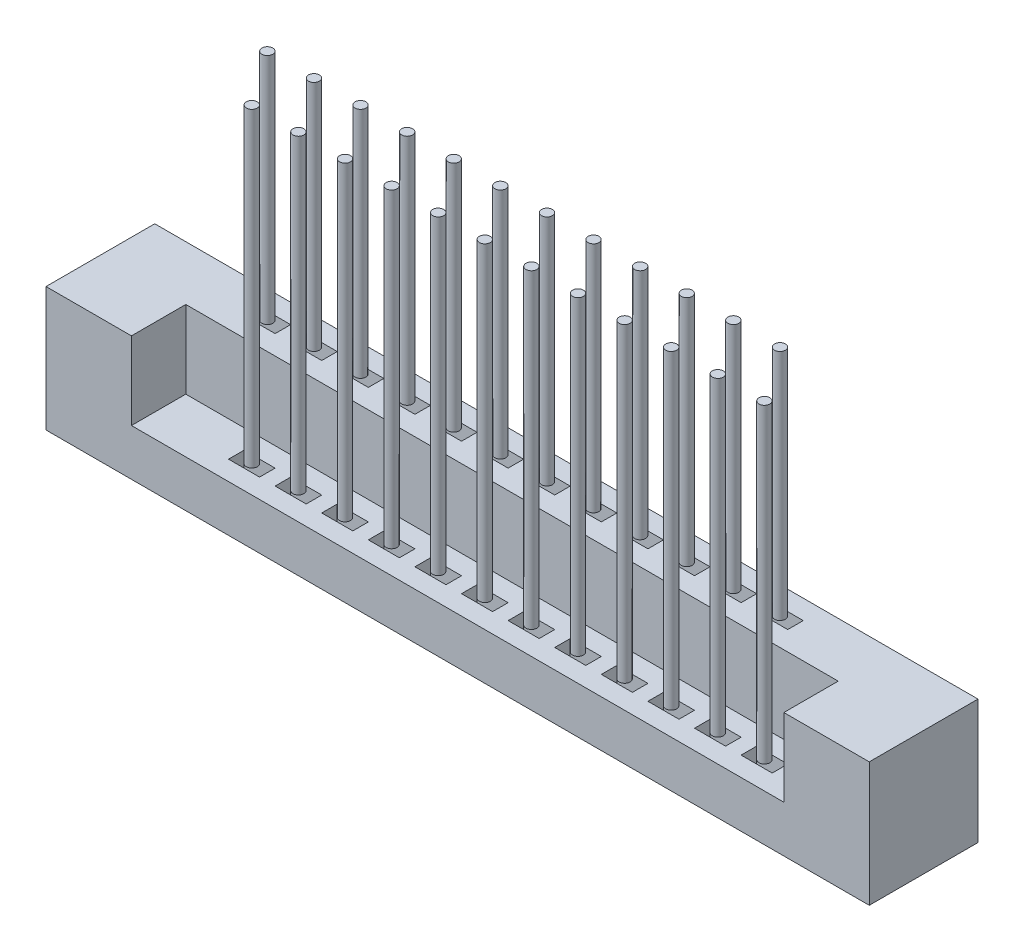
from build123d import *

# Parameters (mm, degrees)
SKETCH1_W               = 53
SKETCH1_H               = 7
BOSS_EXTRUDE2_DEPTH     = 8
SKETCH2_W               = 42
SKETCH2_H               = 3.5
CUT_EXTRUDE1_DEPTH      = 5
SKETCH3_W               = 2
SKETCH3_H               = 1
CUT_EXTRUDE2_DEPTH      = 2
SKETCH4_W               = 2
SKETCH4_H               = 1
CUT_EXTRUDE3_DEPTH      = 2
SKETCH5_R               = 0.35
BOSS_EXTRUDE8_DEPTH     = 20
BOSS_EXTRUDE8_2_DEPTH   = 20
BOSS_EXTRUDE8_3_DEPTH   = 20
BOSS_EXTRUDE8_4_DEPTH   = 20
BOSS_EXTRUDE8_5_DEPTH   = 20
BOSS_EXTRUDE8_6_DEPTH   = 20
BOSS_EXTRUDE8_7_DEPTH   = 20
BOSS_EXTRUDE8_8_DEPTH   = 20
BOSS_EXTRUDE8_9_DEPTH   = 20
BOSS_EXTRUDE8_10_DEPTH  = 20
BOSS_EXTRUDE8_11_DEPTH  = 20
BOSS_EXTRUDE8_12_DEPTH  = 20
SKETCH6_R               = 0.35
BOSS_EXTRUDE11_DEPTH    = 15
BOSS_EXTRUDE11_2_DEPTH  = 15
BOSS_EXTRUDE11_3_DEPTH  = 15
BOSS_EXTRUDE11_4_DEPTH  = 15
BOSS_EXTRUDE11_5_DEPTH  = 15
BOSS_EXTRUDE11_6_DEPTH  = 15
BOSS_EXTRUDE11_7_DEPTH  = 15
BOSS_EXTRUDE11_8_DEPTH  = 15
BOSS_EXTRUDE11_9_DEPTH  = 15
BOSS_EXTRUDE11_10_DEPTH = 15
BOSS_EXTRUDE11_11_DEPTH = 15
BOSS_EXTRUDE11_12_DEPTH = 15


with BuildPart() as part:
    # Sketch1 → Boss-Extrude2 (new body)
    with BuildSketch(Plane(origin=(0, 0, 0), x_dir=(1, 0, 0), z_dir=(0, 1, 0))):
        with Locations((26.5, 3.5)):
            Rectangle(SKETCH1_W, SKETCH1_H)
    extrude(amount=BOSS_EXTRUDE2_DEPTH)

    # Sketch2 → Cut-Extrude1 (cut)
    with BuildSketch(Plane(origin=(0, 8, 0), x_dir=(1, 0, 0), z_dir=(0, 1, 0))):
        with Locations((26.5, 1.75)):
            Rectangle(SKETCH2_W, SKETCH2_H)
    extrude(amount=-CUT_EXTRUDE1_DEPTH, mode=Mode.SUBTRACT)

    # Sketch3 → Cut-Extrude2 (cut)
    with BuildSketch(Plane(origin=(0, 8, 0), x_dir=(1, 0, 0), z_dir=(0, 1, 0))):
        with Locations((44.5, 1.75)):
            Rectangle(SKETCH3_W, SKETCH3_H)
        with Locations((42, 5.25)):
            Rectangle(SKETCH3_W, SKETCH3_H)
        with Locations((41.5, 1.75)):
            Rectangle(SKETCH3_W, SKETCH3_H)
        with Locations((39, 5.25)):
            Rectangle(SKETCH3_W, SKETCH3_H)
        with Locations((38.5, 1.75)):
            Rectangle(SKETCH3_W, SKETCH3_H)
        with Locations((36, 5.25)):
            Rectangle(SKETCH3_W, SKETCH3_H)
        with Locations((35.5, 1.75)):
            Rectangle(SKETCH3_W, SKETCH3_H)
        with Locations((33, 5.25)):
            Rectangle(SKETCH3_W, SKETCH3_H)
        with Locations((32.5, 1.75)):
            Rectangle(SKETCH3_W, SKETCH3_H)
        with Locations((30, 5.25)):
            Rectangle(SKETCH3_W, SKETCH3_H)
        with Locations((29.5, 1.75)):
            Rectangle(SKETCH3_W, SKETCH3_H)
        with Locations((27, 5.25)):
            Rectangle(SKETCH3_W, SKETCH3_H)
        with Locations((26.5, 1.75)):
            Rectangle(SKETCH3_W, SKETCH3_H)
        with Locations((24, 5.25)):
            Rectangle(SKETCH3_W, SKETCH3_H)
        with Locations((23.5, 1.75)):
            Rectangle(SKETCH3_W, SKETCH3_H)
        with Locations((21, 5.25)):
            Rectangle(SKETCH3_W, SKETCH3_H)
        with Locations((20.5, 1.75)):
            Rectangle(SKETCH3_W, SKETCH3_H)
        with Locations((18, 5.25)):
            Rectangle(SKETCH3_W, SKETCH3_H)
        with Locations((17.5, 1.75)):
            Rectangle(SKETCH3_W, SKETCH3_H)
        with Locations((15, 5.25)):
            Rectangle(SKETCH3_W, SKETCH3_H)
        with Locations((14.5, 1.75)):
            Rectangle(SKETCH3_W, SKETCH3_H)
        with Locations((12, 5.25)):
            Rectangle(SKETCH3_W, SKETCH3_H)
        with Locations((11.5, 1.75)):
            Rectangle(SKETCH3_W, SKETCH3_H)
        with Locations((9, 5.25)):
            Rectangle(SKETCH3_W, SKETCH3_H)
    extrude(amount=-CUT_EXTRUDE2_DEPTH, mode=Mode.SUBTRACT)

    # Sketch4 → Cut-Extrude3 (cut)
    with BuildSketch(Plane(origin=(0, 3, 0), x_dir=(1, 0, 0), z_dir=(0, 1, 0))):
        with Locations((44.5, 1.75)):
            Rectangle(SKETCH4_W, SKETCH4_H)
        with Locations((41.5, 1.75)):
            Rectangle(SKETCH4_W, SKETCH4_H)
        with Locations((38.5, 1.75)):
            Rectangle(SKETCH4_W, SKETCH4_H)
        with Locations((35.5, 1.75)):
            Rectangle(SKETCH4_W, SKETCH4_H)
        with Locations((32.5, 1.75)):
            Rectangle(SKETCH4_W, SKETCH4_H)
        with Locations((29.5, 1.75)):
            Rectangle(SKETCH4_W, SKETCH4_H)
        with Locations((26.5, 1.75)):
            Rectangle(SKETCH4_W, SKETCH4_H)
        with Locations((23.5, 1.75)):
            Rectangle(SKETCH4_W, SKETCH4_H)
        with Locations((20.5, 1.75)):
            Rectangle(SKETCH4_W, SKETCH4_H)
        with Locations((17.5, 1.75)):
            Rectangle(SKETCH4_W, SKETCH4_H)
        with Locations((14.5, 1.75)):
            Rectangle(SKETCH4_W, SKETCH4_H)
        with Locations((11.5, 1.75)):
            Rectangle(SKETCH4_W, SKETCH4_H)
    extrude(amount=-CUT_EXTRUDE3_DEPTH, mode=Mode.SUBTRACT)


with BuildPart() as body_2:
    # Sketch5 → Boss-Extrude8 (new body)
    with BuildSketch(Plane(origin=(0, 3, 0), x_dir=(1, 0, 0), z_dir=(0, 1, 0))):
        with Locations(Location((44.5, 1.75, 0), (0, 0, 270))):
            Circle(SKETCH5_R)
    extrude(amount=BOSS_EXTRUDE8_DEPTH)


with BuildPart() as body_3:
    # Sketch5 → Boss-Extrude8 2 (new body)
    with BuildSketch(Plane(origin=(0, 3, 0), x_dir=(1, 0, 0), z_dir=(0, 1, 0))):
        with Locations(Location((41.5, 1.75, 0), (0, 0, 270))):
            Circle(SKETCH5_R)
    extrude(amount=BOSS_EXTRUDE8_2_DEPTH)


with BuildPart() as body_4:
    # Sketch5 → Boss-Extrude8 3 (new body)
    with BuildSketch(Plane(origin=(0, 3, 0), x_dir=(1, 0, 0), z_dir=(0, 1, 0))):
        with Locations(Location((38.5, 1.75, 0), (0, 0, 270))):
            Circle(SKETCH5_R)
    extrude(amount=BOSS_EXTRUDE8_3_DEPTH)


with BuildPart() as body_5:
    # Sketch5 → Boss-Extrude8 4 (new body)
    with BuildSketch(Plane(origin=(0, 3, 0), x_dir=(1, 0, 0), z_dir=(0, 1, 0))):
        with Locations(Location((35.5, 1.75, 0), (0, 0, 270))):
            Circle(SKETCH5_R)
    extrude(amount=BOSS_EXTRUDE8_4_DEPTH)


with BuildPart() as body_6:
    # Sketch5 → Boss-Extrude8 5 (new body)
    with BuildSketch(Plane(origin=(0, 3, 0), x_dir=(1, 0, 0), z_dir=(0, 1, 0))):
        with Locations(Location((32.5, 1.75, 0), (0, 0, 270))):
            Circle(SKETCH5_R)
    extrude(amount=BOSS_EXTRUDE8_5_DEPTH)


with BuildPart() as body_7:
    # Sketch5 → Boss-Extrude8 6 (new body)
    with BuildSketch(Plane(origin=(0, 3, 0), x_dir=(1, 0, 0), z_dir=(0, 1, 0))):
        with Locations(Location((29.5, 1.75, 0), (0, 0, 270))):
            Circle(SKETCH5_R)
    extrude(amount=BOSS_EXTRUDE8_6_DEPTH)


with BuildPart() as body_8:
    # Sketch5 → Boss-Extrude8 7 (new body)
    with BuildSketch(Plane(origin=(0, 3, 0), x_dir=(1, 0, 0), z_dir=(0, 1, 0))):
        with Locations(Location((26.5, 1.75, 0), (0, 0, 270))):
            Circle(SKETCH5_R)
    extrude(amount=BOSS_EXTRUDE8_7_DEPTH)


with BuildPart() as body_9:
    # Sketch5 → Boss-Extrude8 8 (new body)
    with BuildSketch(Plane(origin=(0, 3, 0), x_dir=(1, 0, 0), z_dir=(0, 1, 0))):
        with Locations(Location((23.5, 1.75, 0), (0, 0, 270))):
            Circle(SKETCH5_R)
    extrude(amount=BOSS_EXTRUDE8_8_DEPTH)


with BuildPart() as body_10:
    # Sketch5 → Boss-Extrude8 9 (new body)
    with BuildSketch(Plane(origin=(0, 3, 0), x_dir=(1, 0, 0), z_dir=(0, 1, 0))):
        with Locations(Location((20.5, 1.75, 0), (0, 0, 270))):
            Circle(SKETCH5_R)
    extrude(amount=BOSS_EXTRUDE8_9_DEPTH)


with BuildPart() as body_11:
    # Sketch5 → Boss-Extrude8 10 (new body)
    with BuildSketch(Plane(origin=(0, 3, 0), x_dir=(1, 0, 0), z_dir=(0, 1, 0))):
        with Locations(Location((17.5, 1.75, 0), (0, 0, 270))):
            Circle(SKETCH5_R)
    extrude(amount=BOSS_EXTRUDE8_10_DEPTH)


with BuildPart() as body_12:
    # Sketch5 → Boss-Extrude8 11 (new body)
    with BuildSketch(Plane(origin=(0, 3, 0), x_dir=(1, 0, 0), z_dir=(0, 1, 0))):
        with Locations(Location((14.5, 1.75, 0), (0, 0, 270))):
            Circle(SKETCH5_R)
    extrude(amount=BOSS_EXTRUDE8_11_DEPTH)


with BuildPart() as body_13:
    # Sketch5 → Boss-Extrude8 12 (new body)
    with BuildSketch(Plane(origin=(0, 3, 0), x_dir=(1, 0, 0), z_dir=(0, 1, 0))):
        with Locations(Location((11.5, 1.75, 0), (0, 0, 270))):
            Circle(SKETCH5_R)
    extrude(amount=BOSS_EXTRUDE8_12_DEPTH)


with BuildPart() as body_14:
    # Sketch6 → Boss-Extrude11 (new body)
    with BuildSketch(Plane(origin=(0, 8, 0), x_dir=(1, 0, 0), z_dir=(0, 1, 0))):
        with Locations(Location((42, 5.25, 0), (0, 0, 270))):
            Circle(SKETCH6_R)
    extrude(amount=BOSS_EXTRUDE11_DEPTH)


with BuildPart() as body_15:
    # Sketch6 → Boss-Extrude11 2 (new body)
    with BuildSketch(Plane(origin=(0, 8, 0), x_dir=(1, 0, 0), z_dir=(0, 1, 0))):
        with Locations(Location((39, 5.25, 0), (0, 0, 270))):
            Circle(SKETCH6_R)
    extrude(amount=BOSS_EXTRUDE11_2_DEPTH)


with BuildPart() as body_16:
    # Sketch6 → Boss-Extrude11 3 (new body)
    with BuildSketch(Plane(origin=(0, 8, 0), x_dir=(1, 0, 0), z_dir=(0, 1, 0))):
        with Locations(Location((36, 5.25, 0), (0, 0, 270))):
            Circle(SKETCH6_R)
    extrude(amount=BOSS_EXTRUDE11_3_DEPTH)


with BuildPart() as body_17:
    # Sketch6 → Boss-Extrude11 4 (new body)
    with BuildSketch(Plane(origin=(0, 8, 0), x_dir=(1, 0, 0), z_dir=(0, 1, 0))):
        with Locations(Location((33, 5.25, 0), (0, 0, 270))):
            Circle(SKETCH6_R)
    extrude(amount=BOSS_EXTRUDE11_4_DEPTH)


with BuildPart() as body_18:
    # Sketch6 → Boss-Extrude11 5 (new body)
    with BuildSketch(Plane(origin=(0, 8, 0), x_dir=(1, 0, 0), z_dir=(0, 1, 0))):
        with Locations(Location((30, 5.25, 0), (0, 0, 270))):
            Circle(SKETCH6_R)
    extrude(amount=BOSS_EXTRUDE11_5_DEPTH)


with BuildPart() as body_19:
    # Sketch6 → Boss-Extrude11 6 (new body)
    with BuildSketch(Plane(origin=(0, 8, 0), x_dir=(1, 0, 0), z_dir=(0, 1, 0))):
        with Locations(Location((27, 5.25, 0), (0, 0, 270))):
            Circle(SKETCH6_R)
    extrude(amount=BOSS_EXTRUDE11_6_DEPTH)


with BuildPart() as body_20:
    # Sketch6 → Boss-Extrude11 7 (new body)
    with BuildSketch(Plane(origin=(0, 8, 0), x_dir=(1, 0, 0), z_dir=(0, 1, 0))):
        with Locations(Location((24, 5.25, 0), (0, 0, 270))):
            Circle(SKETCH6_R)
    extrude(amount=BOSS_EXTRUDE11_7_DEPTH)


with BuildPart() as body_21:
    # Sketch6 → Boss-Extrude11 8 (new body)
    with BuildSketch(Plane(origin=(0, 8, 0), x_dir=(1, 0, 0), z_dir=(0, 1, 0))):
        with Locations(Location((21, 5.25, 0), (0, 0, 270))):
            Circle(SKETCH6_R)
    extrude(amount=BOSS_EXTRUDE11_8_DEPTH)


with BuildPart() as body_22:
    # Sketch6 → Boss-Extrude11 9 (new body)
    with BuildSketch(Plane(origin=(0, 8, 0), x_dir=(1, 0, 0), z_dir=(0, 1, 0))):
        with Locations(Location((18, 5.25, 0), (0, 0, 270))):
            Circle(SKETCH6_R)
    extrude(amount=BOSS_EXTRUDE11_9_DEPTH)


with BuildPart() as body_23:
    # Sketch6 → Boss-Extrude11 10 (new body)
    with BuildSketch(Plane(origin=(0, 8, 0), x_dir=(1, 0, 0), z_dir=(0, 1, 0))):
        with Locations(Location((15, 5.25, 0), (0, 0, 270))):
            Circle(SKETCH6_R)
    extrude(amount=BOSS_EXTRUDE11_10_DEPTH)


with BuildPart() as body_24:
    # Sketch6 → Boss-Extrude11 11 (new body)
    with BuildSketch(Plane(origin=(0, 8, 0), x_dir=(1, 0, 0), z_dir=(0, 1, 0))):
        with Locations(Location((12, 5.25, 0), (0, 0, 270))):
            Circle(SKETCH6_R)
    extrude(amount=BOSS_EXTRUDE11_11_DEPTH)


with BuildPart() as body_25:
    # Sketch6 → Boss-Extrude11 12 (new body)
    with BuildSketch(Plane(origin=(0, 8, 0), x_dir=(1, 0, 0), z_dir=(0, 1, 0))):
        with Locations(Location((9, 5.25, 0), (0, 0, 270))):
            Circle(SKETCH6_R)
    extrude(amount=BOSS_EXTRUDE11_12_DEPTH)


solid = Compound([part.part, body_2.part, body_3.part, body_4.part, body_5.part, body_6.part, body_7.part, body_8.part, body_9.part, body_10.part, body_11.part, body_12.part, body_13.part, body_14.part, body_15.part, body_16.part, body_17.part, body_18.part, body_19.part, body_20.part, body_21.part, body_22.part, body_23.part, body_24.part, body_25.part])
